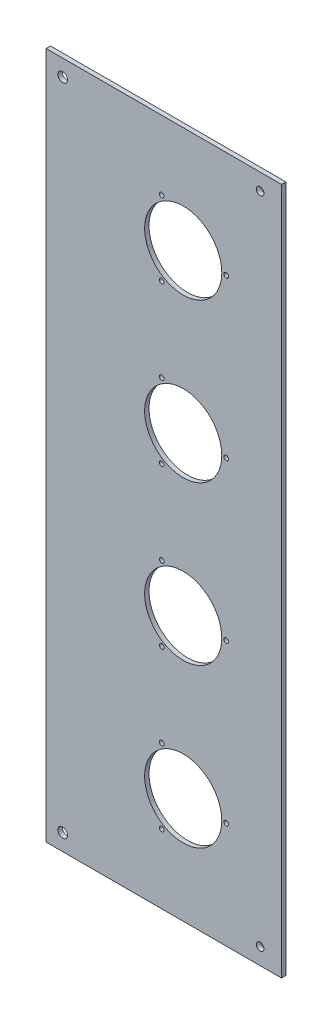
from build123d import *

# Parameters (mm, degrees)
SKETCH1_W           = 500
SKETCH1_H           = 171.83
SKETCH1_R           = 1.7
SKETCH1_R_2         = 28
SKETCH1_R_3         = 2.8
SKETCH1_R_4         = 3.5
BOSS_EXTRUDE1_DEPTH = 3.175
SKETCH2_W           = 171.83
SKETCH2_H           = 500
SKETCH2_W_2         = 170.83
SKETCH2_H_2         = 499
CUT_EXTRUDE1_DEPTH  = 3.175


with BuildPart() as part:
    # Sketch1 → Boss-Extrude1 (new body)
    with BuildSketch(Plane(origin=(0, 0, 0), x_dir=(0, 1, 0), z_dir=(0, 0, 1))):
        Rectangle(SKETCH1_W, SKETCH1_H)
        with Locations(Location((57.42, -45.305, 0), (0, 0, 270))):
            Circle(SKETCH1_R, mode=Mode.SUBTRACT)
        with Locations(Location((30.382686894, 1.525, 0), (0, 0, 270))):
            Circle(SKETCH1_R, mode=Mode.SUBTRACT)
        with Locations(Location((84.457313106, 1.525, 0), (0, 0, 270))):
            Circle(SKETCH1_R, mode=Mode.SUBTRACT)
        with Locations(Location((145.212686894, 1.525, 0), (0, 0, 270))):
            Circle(SKETCH1_R, mode=Mode.SUBTRACT)
        with Locations(Location((-57.42, -45.305, 0), (0, 0, 270))):
            Circle(SKETCH1_R, mode=Mode.SUBTRACT)
        with Locations(Location((-30.382686894, 1.525, 0), (0, 0, 270))):
            Circle(SKETCH1_R, mode=Mode.SUBTRACT)
        with Locations(Location((-145.212686894, 1.525, 0), (0, 0, 270))):
            Circle(SKETCH1_R, mode=Mode.SUBTRACT)
        with Locations(Location((-199.287313106, 1.525, 0), (0, 0, 270))):
            Circle(SKETCH1_R, mode=Mode.SUBTRACT)
        with Locations(Location((-172.25, -45.305, 0), (0, 0, 270))):
            Circle(SKETCH1_R, mode=Mode.SUBTRACT)
        with Locations(Location((172.25, -14.085, 0), (0, 0, 270))):
            Circle(SKETCH1_R_2, mode=Mode.SUBTRACT)
        with Locations(Location((-57.42, -14.085, 0), (0, 0, 270))):
            Circle(SKETCH1_R_2, mode=Mode.SUBTRACT)
        with Locations(Location((-172.25, -14.085, 0), (0, 0, 270))):
            Circle(SKETCH1_R_2, mode=Mode.SUBTRACT)
        with Locations(Location((237.5, -69.915, 0), (0, 0, 270))):
            Circle(SKETCH1_R_3, mode=Mode.SUBTRACT)
        with Locations(Location((-237.5, -69.915, 0), (0, 0, 270))):
            Circle(SKETCH1_R_3, mode=Mode.SUBTRACT)
        with Locations(Location((237.5, 73.415, 0), (0, 0, 270))):
            Circle(SKETCH1_R_4, mode=Mode.SUBTRACT)
        with Locations(Location((-237.5, 73.415, 0), (0, 0, 270))):
            Circle(SKETCH1_R_4, mode=Mode.SUBTRACT)
        with Locations(Location((57.42, -14.085, 0), (0, 0, 270))):
            Circle(SKETCH1_R_2, mode=Mode.SUBTRACT)
        with Locations(Location((-84.457313106, 1.525, 0), (0, 0, 270))):
            Circle(SKETCH1_R, mode=Mode.SUBTRACT)
        with Locations(Location((199.287313106, 1.525, 0), (0, 0, 270))):
            Circle(SKETCH1_R, mode=Mode.SUBTRACT)
        with Locations(Location((172.25, -45.305, 0), (0, 0, 270))):
            Circle(SKETCH1_R, mode=Mode.SUBTRACT)
    extrude(amount=BOSS_EXTRUDE1_DEPTH)

    # Sketch2 → Cut-Extrude1 (cut)
    with BuildSketch(Plane.XY.offset(3.175)):
        Rectangle(SKETCH2_W, SKETCH2_H)
        Rectangle(SKETCH2_W_2, SKETCH2_H_2, mode=Mode.SUBTRACT)
    extrude(amount=-CUT_EXTRUDE1_DEPTH, mode=Mode.SUBTRACT)


solid = part.part
